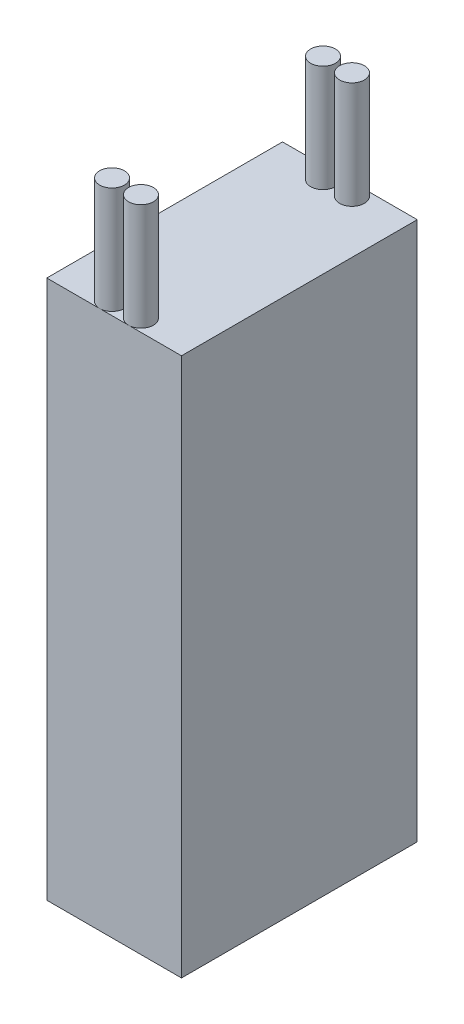
from build123d import *

# Parameters (mm, degrees)
SKETCH1_W           = 16
SKETCH1_H           = 28
BOSS_EXTRUDE1_DEPTH = 64
SKETCH2_R           = 1.469936724
BOSS_EXTRUDE8_DEPTH = 12.7


with BuildPart() as part:
    # Sketch1 → Boss-Extrude1 (new body)
    with BuildSketch(Plane(origin=(0, 0, 0), x_dir=(1, 0, 0), z_dir=(0, 1, 0))):
        with Locations((8, 14)):
            Rectangle(SKETCH1_W, SKETCH1_H)
    extrude(amount=BOSS_EXTRUDE1_DEPTH)

    # Sketch2 → Boss-Extrude8 (add)
    with BuildSketch(Plane(origin=(0, 64, 0), x_dir=(1, 0, 0), z_dir=(0, 1, 0))):
        with Locations(Location((6.280063122, 26.530063276, 0), (0, 0, 90))):
            Circle(SKETCH2_R)
        with Locations(Location((9.719936624, 26.530063276, 0), (0, 0, 90))):
            Circle(SKETCH2_R)
        with Locations(Location((6.280063122, 1.469936724, 0), (0, 0, 90))):
            Circle(SKETCH2_R)
        with Locations(Location((9.719936624, 1.469936724, 0), (0, 0, 90))):
            Circle(SKETCH2_R)
    extrude(amount=BOSS_EXTRUDE8_DEPTH)


solid = part.part
